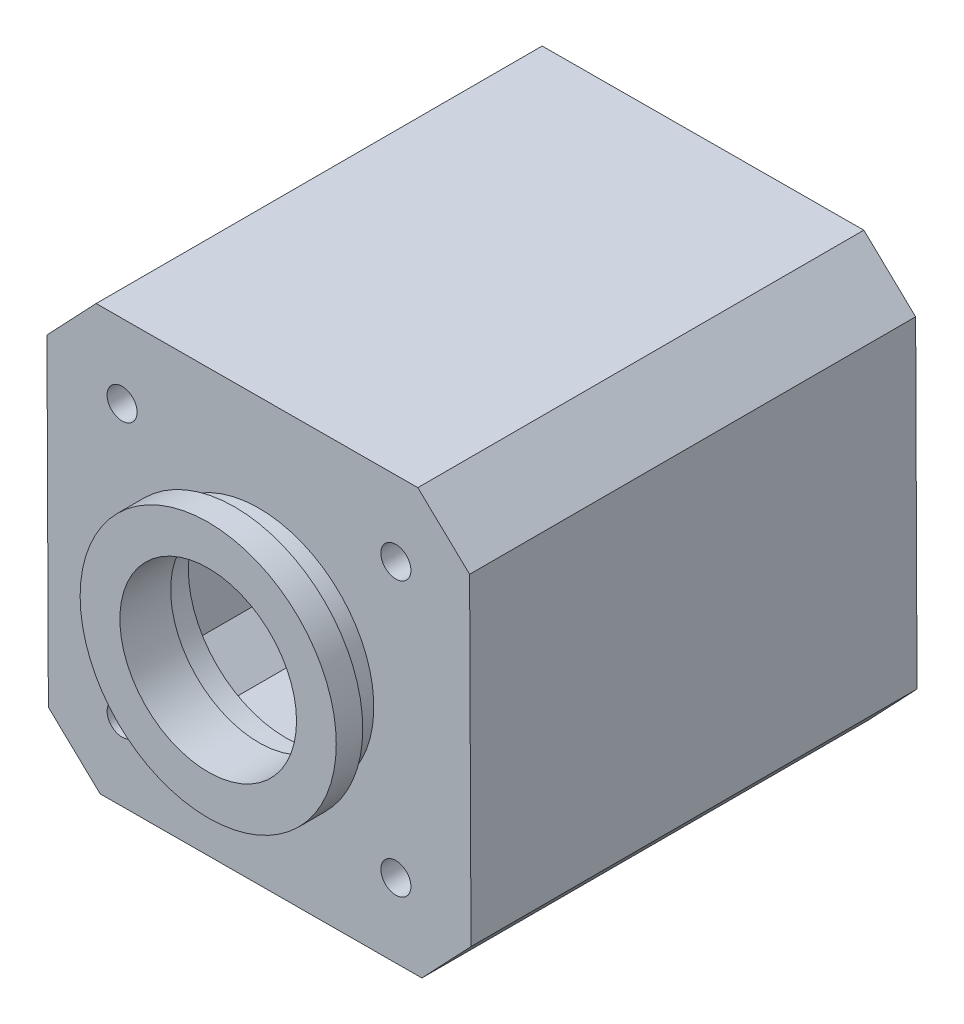
from build123d import *

# Parameters (mm, degrees)
CROQUIS1_R              = 1.7
SALIENTE_EXTRUIR1_DEPTH = 3
CROQUIS17_R             = 11
CORTAR_EXTRUIR7_DEPTH   = 30
CROQUIS19_R             = 13
SALIENTE_EXTRUIR3_DEPTH = 7.25
CROQUIS20_R             = 10
CORTAR_EXTRUIR8_DEPTH   = 14
CORTAR_EXTRUIR9_START   = -1.5
CROQUIS22_R             = 13
CORTAR_EXTRUIR9_DEPTH   = 1.5
SALIENTE_EXTRUIR4_START = -3
CROQUIS23_R             = 14.5
CROQUIS23_R_2           = 13
SALIENTE_EXTRUIR4_DEPTH = 3
SALIENTE_EXTRUIR6_DEPTH = 50.5


with BuildPart() as part:
    # Croquis1 → Saliente-Extruir1 (new body)
    with BuildSketch(Plane.XY):
        Polygon((-20.912159123, -17.544678887), (-21.058605733, 16.394660941), (-17.205052342, 20.455321113), (16.734287486, 20.601767722), (20.794947658, 16.748214331), (20.941394267, -17.191125497), (17.087840877, -21.251785669), (-16.851498951, -21.398232278), align=None)
        with Locations((-15.558605733, 15.101767722)):
            Circle(CROQUIS1_R, mode=Mode.SUBTRACT)
        with Locations((15.441394267, 15.101767722)):
            Circle(CROQUIS1_R, mode=Mode.SUBTRACT)
        with Locations((15.441394267, -15.898232278)):
            Circle(CROQUIS1_R, mode=Mode.SUBTRACT)
        with Locations((-15.558605733, -15.898232278)):
            Circle(CROQUIS1_R, mode=Mode.SUBTRACT)
    extrude(amount=SALIENTE_EXTRUIR1_DEPTH)

    # Croquis17 → Cortar-Extruir7 (cut)
    with BuildSketch(Plane.XY.offset(3)):
        with Locations((-0.058605733, -0.398232278)):
            Circle(CROQUIS17_R)
    extrude(amount=-CORTAR_EXTRUIR7_DEPTH, mode=Mode.SUBTRACT)

    # Croquis19 → Saliente-Extruir3 (add)
    with BuildSketch(Plane.XY.offset(3)):
        with Locations(Location((-0.058605733, -0.398232278, 0), (0, 0, 180))):
            Circle(CROQUIS19_R)
    extrude(amount=SALIENTE_EXTRUIR3_DEPTH)

    # Croquis20 → Cortar-Extruir8 (cut)
    with BuildSketch(Plane.XY.offset(10.25)):
        with Locations((-0.058605733, -0.398232278)):
            Circle(CROQUIS20_R)
    extrude(amount=-CORTAR_EXTRUIR8_DEPTH, mode=Mode.SUBTRACT)

    # Croquis22 → Cortar-Extruir9 (cut)
    with BuildSketch(Plane.XY.offset(10.25).offset(CORTAR_EXTRUIR9_START)):
        with Locations(Location((-0.058605733, -0.398232278, 0), (0, 0, 180))):
            Circle(CROQUIS22_R)
    extrude(amount=CORTAR_EXTRUIR9_DEPTH, mode=Mode.SUBTRACT)

    # Croquis23 → Saliente-Extruir4 (add)
    with BuildSketch(Plane.XY.offset(8.75).offset(SALIENTE_EXTRUIR4_START)):
        with Locations((-0.058605733, -0.398232278)):
            Circle(CROQUIS23_R)
        with Locations(Location((-0.058605733, -0.398232278, 0), (0, 0, 180))):
            Circle(CROQUIS23_R_2, mode=Mode.SUBTRACT)
    extrude(amount=SALIENTE_EXTRUIR4_DEPTH)

    # Croquis25 → Saliente-Extruir6 (add)
    with BuildSketch(Plane.XY.offset(3)):
        Polygon((-24.063774758, 17.586122209), (-18.499196808, 23.44976487), (17.925748755, 23.606936748), (23.789391415, 18.042358797), (23.946563293, -18.382586765), (18.381985343, -24.246229426), (-18.04296022, -24.403401304), (-23.906602881, -18.838823353), align=None)
        Polygon((-20.912159123, -17.544678887), (-16.851498951, -21.398232278), (17.087840877, -21.251785669), (20.941394267, -17.191125497), (20.794947658, 16.748214331), (16.734287486, 20.601767722), (-17.205052342, 20.455321113), (-21.058605733, 16.394660941), align=None, mode=Mode.SUBTRACT)
    extrude(amount=-SALIENTE_EXTRUIR6_DEPTH)


solid = part.part
